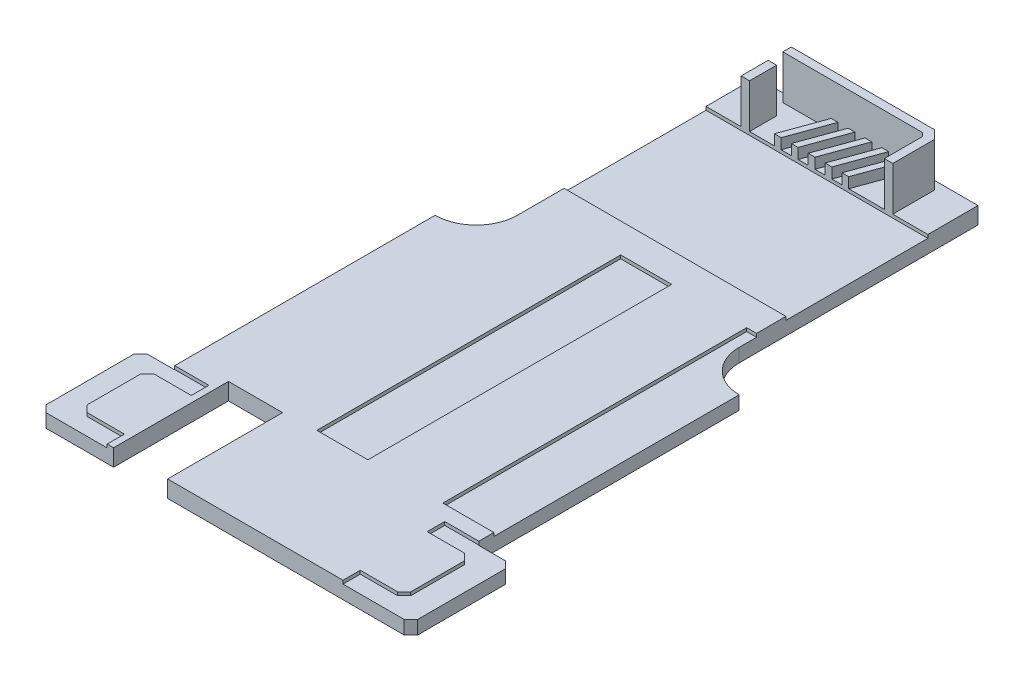
from build123d import *

# Parameters (mm, degrees)
SKETCH1_W                = 90
SKETCH1_H                = 190
BOSS_EXTRUDE1_DEPTH      = 5
SKETCH2_W                = 10
SKETCH2_H                = 30
BOSS_EXTRUDE2_DEPTH      = 5
CHAMFER1_SIZE            = 2
SKETCH3_W                = 16
SKETCH3_H                = 34
CUT_EXTRUDE1_DEPTH       = 50
SKETCH4_W                = 90
SKETCH4_H                = 42
CUT_EXTRUDE2_DEPTH       = 1
SKETCH7_W                = 15.1
SKETCH7_H                = 89.916335477
CUT_EXTRUDE7_DEPTH       = 1
CUT_EXTRUDE8_DEPTH       = 1
CUT_EXTRUDE9_DEPTH       = 110.886304879
CUT_EXTRUDE9_DEPTH_BACK  = 110.886304879
CUT_EXTRUDE10_DEPTH      = 110.886304879
CUT_EXTRUDE10_DEPTH_BACK = 110.886304879
BOSS_EXTRUDE4_START      = 5
SKETCH17_W               = 2.5
SKETCH17_H               = 8
BOSS_EXTRUDE4_DEPTH      = 13
BOSS_EXTRUDE5_DEPTH      = 3.1


with BuildPart() as part:
    # Sketch1 → Boss-Extrude1 (new body)
    with BuildSketch(Plane(origin=(0, 0, 0), x_dir=(1, 0, 0), z_dir=(0, 1, 0))):
        Rectangle(SKETCH1_W, SKETCH1_H)
    extrude(amount=BOSS_EXTRUDE1_DEPTH)

    # Sketch2 → Boss-Extrude2 (add)
    with BuildSketch(Plane(origin=(0, 0, 0), x_dir=(1, 0, 0), z_dir=(0, 1, 0))):
        with Locations((-50, -80)):
            Rectangle(SKETCH2_W, SKETCH2_H)
        with Locations((50, -80)):
            Rectangle(SKETCH2_W, SKETCH2_H)
    extrude(amount=BOSS_EXTRUDE2_DEPTH)

    # Chamfer1
    chamfer1_edges = [part.edges().sort_by_distance(p)[0] for p in [
        (-55, 2.5, 65),
        (-55, 2.5, 95),
        (55, 2.5, 95),
        (55, 2.5, 65),
    ]]
    chamfer(chamfer1_edges, length=CHAMFER1_SIZE)

    # Sketch3 → Cut-Extrude1 (cut)
    with BuildSketch(Plane(origin=(0, 5, 0), x_dir=(1, 0, 0), z_dir=(0, 1, 0))):
        with Locations((-25, -78)):
            Rectangle(SKETCH3_W, SKETCH3_H)
    extrude(amount=-CUT_EXTRUDE1_DEPTH, mode=Mode.SUBTRACT)

    # Sketch4 → Cut-Extrude2 (cut)
    with BuildSketch(Plane(origin=(0, 5, 0), x_dir=(1, 0, 0), z_dir=(0, 1, 0))):
        with Locations((0, 59.159820088)):
            Rectangle(SKETCH4_W, SKETCH4_H)
    extrude(amount=-CUT_EXTRUDE2_DEPTH, mode=Mode.SUBTRACT)

    # Sketch7 → Cut-Extrude7 (cut)
    with BuildSketch(Plane(origin=(0, 5, 0), x_dir=(1, 0, 0), z_dir=(0, 1, 0))):
        with Locations((37.45, -15.495273531)):
            Rectangle(SKETCH7_W, SKETCH7_H)
        with Locations((0.16773297, -15.495273531)):
            Rectangle(SKETCH7_W, SKETCH7_H)
    extrude(amount=-CUT_EXTRUDE7_DEPTH, mode=Mode.SUBTRACT)

    # Sketch8 → Cut-Extrude8 (cut)
    with BuildSketch(Plane(origin=(0, 5, 0), x_dir=(1, 0, 0), z_dir=(0, 1, 0))):
        Polygon((-34.9, -70.1), (-45.958578644, -70.1), (-47.9, -72.041421356), (-47.9, -87.958578644), (-45.958578644, -89.9), (-34.9, -89.9), (-34.9, -95.1), (-53.041421356, -95.1), (-55.1, -93.041421356), (-55.1, -66.958578644), (-53.041421356, -64.9), (-34.9, -64.9), align=None)
    cut_extrude8 = extrude(amount=-CUT_EXTRUDE8_DEPTH, mode=Mode.SUBTRACT)

    # Mirror1: Cut-Extrude8 across plane
    add(cut_extrude8.mirror(Plane(origin=(0, 0, 0), x_dir=(0, 0, 1), z_dir=(1, 0, 0))), mode=Mode.SUBTRACT)

    # Sketch14 → Cut-Extrude9 (cut, two sides: drawn at the far end of the back side and taken through both)
    with BuildSketch(Plane(origin=(0, 0, 0), x_dir=(1, 0, 0), z_dir=(0, 1, 0)).offset(-CUT_EXTRUDE9_DEPTH_BACK)):
        with BuildLine():
            Line((-45, 47.267125731), (-34.685032462, 30.799006468))
            ThreePointArc((-34.685032462, 30.799006468), (-34.351546651, 18.443044928), (-45, 12.166784925))
            Line((-45, 12.166784925), (-45, 47.267125731))
        make_face()
        with BuildLine():
            Line((45, 47.267125731), (45, 12.166784925))
            ThreePointArc((45, 12.166784925), (34.351546651, 18.443044928), (34.685032462, 30.799006468))
            Line((34.685032462, 30.799006468), (45, 47.267125731))
        make_face()
    extrude(amount=CUT_EXTRUDE9_DEPTH + CUT_EXTRUDE9_DEPTH_BACK, mode=Mode.SUBTRACT)

    # Sketch16 → Cut-Extrude10 (cut, two sides: drawn at the far end of the back side and taken through both)
    with BuildSketch(Plane(origin=(0, 0, 0), x_dir=(1, 0, 0), z_dir=(0, 1, 0)).offset(-CUT_EXTRUDE10_DEPTH_BACK)):
        with BuildLine():
            Line((-32.828659242, 95), (-32.828659242, 24.338125683))
            ThreePointArc((-32.828659242, 24.338125683), (-33.30195485, 27.699267678), (-34.685032462, 30.799006468))
            Line((-34.685032462, 30.799006468), (-45, 47.267125731))
            Line((-45, 47.267125731), (-45, 95))
            Line((-45, 95), (-32.828659242, 95))
        make_face()
        with BuildLine():
            Line((45, 95), (32.828659242, 95))
            Line((32.828659242, 95), (32.828659242, 24.338125683))
            ThreePointArc((32.828659242, 24.338125683), (33.30195485, 27.699267678), (34.685032462, 30.799006468))
            Line((34.685032462, 30.799006468), (45, 47.267125731))
            Line((45, 47.267125731), (45, 95))
        make_face()
    extrude(amount=CUT_EXTRUDE10_DEPTH + CUT_EXTRUDE10_DEPTH_BACK, mode=Mode.SUBTRACT)

    # Sketch17 → Boss-Extrude4 (add)
    with BuildSketch(Plane(origin=(0, 0, 0), x_dir=(1, 0, 0), z_dir=(0, 1, 0)).offset(BOSS_EXTRUDE4_START)):
        with Locations((-21.190023983, 84.159820088)):
            Rectangle(SKETCH17_W, SKETCH17_H)
        Polygon((-22.440023983, 94.999820088), (-22.440023983, 92.499820088), (18.940023983, 92.499820088), (19.940023983, 91.499820088), (19.940023983, 80.159820088), (22.440023983, 80.159820088), (22.440023983, 92.535353994), (19.975557889, 94.999820088), align=None)
    extrude(amount=BOSS_EXTRUDE4_DEPTH)

    # Sketch18 → Boss-Extrude5 (add)
    with BuildSketch(Plane(origin=(0, 5, 0), x_dir=(1, 0, 0), z_dir=(0, 1, 0))):
        Polygon((-12.599634528, 80.159820088), (-10.599634528, 80.159820088), (-6.108241837, 92.499820088), (-8.108241837, 92.499820088), align=None)
        Polygon((-3.108241837, 92.499820088), (-7.599634528, 80.159820088), (-5.599634528, 80.159820088), (-1.108241837, 92.499820088), align=None)
        Polygon((1.891758163, 92.499820088), (-2.599634528, 80.159820088), (-0.599634528, 80.159820088), (3.891758163, 92.499820088), align=None)
        Polygon((6.891758163, 92.499820088), (2.400365472, 80.159820088), (4.400365472, 80.159820088), (8.891758163, 92.499820088), align=None)
        Polygon((11.891758163, 92.499820088), (7.400365472, 80.159820088), (9.400365472, 80.159820088), (13.891758163, 92.499820088), align=None)
    extrude(amount=BOSS_EXTRUDE5_DEPTH)


solid = part.part
